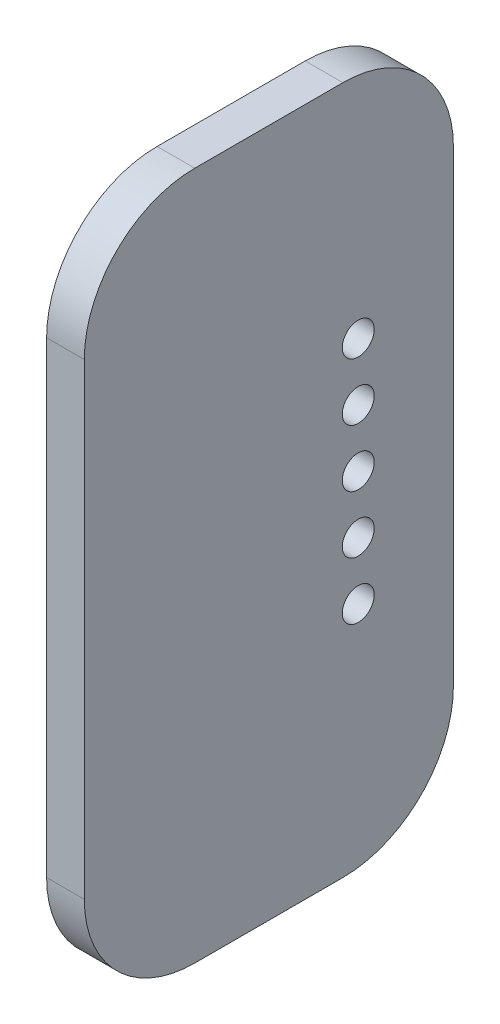
from build123d import *

# Parameters (mm, degrees)
BOSS_1_DEPTH = 2.95
S_HOLE2_R    = 1.25
HOLE_2_DEPTH = 3.2
S_HOLE3_R    = 1.25
HOLE_3_DEPTH = 3.2
S_HOLE4_R    = 1.25
HOLE_4_DEPTH = 3.2
S_HOLE5_R    = 1.25
HOLE_5_DEPTH = 3.2
S_HOLE6_R    = 1.25
HOLE_6_DEPTH = 3.2


with BuildPart() as part:
    # S_prism1 → Boss_1 (new body)
    with BuildSketch(Plane(origin=(34, 0, 0), x_dir=(0, 0, -1), z_dir=(1, 0, 0))):
        with BuildLine():
            Line((-17.55, -18.3), (-17.55, 18.3))
            ThreePointArc((-17.55, 18.3), (-20.0835, 24.4165), (-26.2, 26.95))
            Line((-26.2, 26.95), (-37.8, 26.95))
            ThreePointArc((-37.8, 26.95), (-43.9165, 24.4165), (-46.45, 18.3))
            Line((-46.45, 18.3), (-46.45, -18.3))
            ThreePointArc((-46.45, -18.3), (-43.9165, -24.4165), (-37.8, -26.95))
            Line((-37.8, -26.95), (-26.2, -26.95))
            ThreePointArc((-26.2, -26.95), (-20.0835, -24.4165), (-17.55, -18.3))
        make_face()
    extrude(amount=BOSS_1_DEPTH)

    # S_hole2 → Hole_2 (cut)
    with BuildSketch(Plane(origin=(33.9, 0, 0), x_dir=(0, 0, -1), z_dir=(1, 0, 0))):
        with Locations((-25, -9)):
            Circle(S_HOLE2_R)
    extrude(amount=HOLE_2_DEPTH, mode=Mode.SUBTRACT)

    # S_hole3 → Hole_3 (cut)
    with BuildSketch(Plane(origin=(33.9, 0, 0), x_dir=(0, 0, -1), z_dir=(1, 0, 0))):
        with Locations((-25, -4.5)):
            Circle(S_HOLE3_R)
    extrude(amount=HOLE_3_DEPTH, mode=Mode.SUBTRACT)

    # S_hole4 → Hole_4 (cut)
    with BuildSketch(Plane(origin=(33.9, 0, 0), x_dir=(0, 0, -1), z_dir=(1, 0, 0))):
        with Locations((-25, 0)):
            Circle(S_HOLE4_R)
    extrude(amount=HOLE_4_DEPTH, mode=Mode.SUBTRACT)

    # S_hole5 → Hole_5 (cut)
    with BuildSketch(Plane(origin=(33.9, 0, 0), x_dir=(0, 0, -1), z_dir=(1, 0, 0))):
        with Locations((-25, 4.5)):
            Circle(S_HOLE5_R)
    extrude(amount=HOLE_5_DEPTH, mode=Mode.SUBTRACT)

    # S_hole6 → Hole_6 (cut)
    with BuildSketch(Plane(origin=(33.9, 0, 0), x_dir=(0, 0, -1), z_dir=(1, 0, 0))):
        with Locations((-25, 9)):
            Circle(S_HOLE6_R)
    extrude(amount=HOLE_6_DEPTH, mode=Mode.SUBTRACT)


solid = part.part
